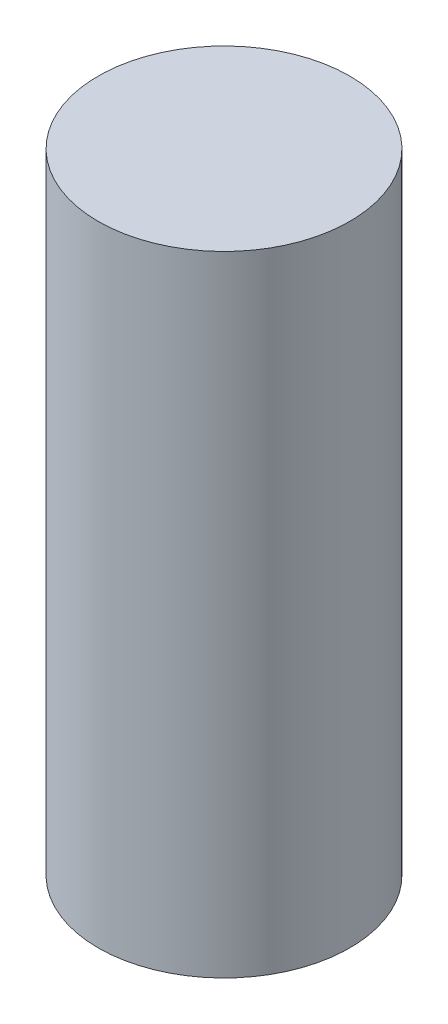
from build123d import *

# Parameters (mm, degrees)
SKETCH1_R           = 10.16
BOSS_EXTRUDE1_DEPTH = 50.8


with BuildPart() as part:
    # Sketch1 → Boss-Extrude1 (new body)
    with BuildSketch(Plane(origin=(0, 0, 0), x_dir=(1, 0, 0), z_dir=(0, 1, 0))):
        with Locations(Location((0, 0, 0), (0, 0, 270))):
            Circle(SKETCH1_R)
    extrude(amount=BOSS_EXTRUDE1_DEPTH)


solid = part.part
